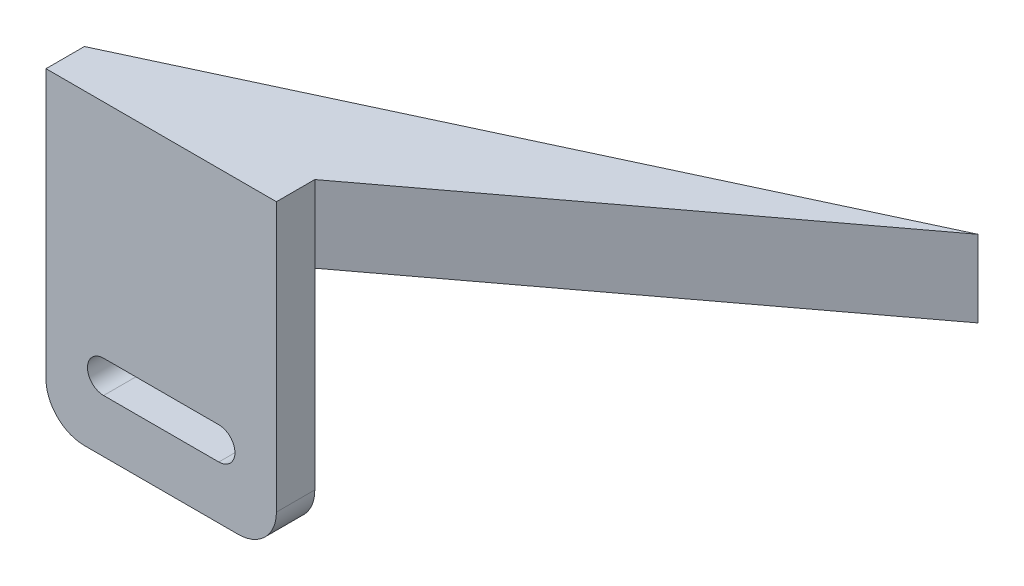
from build123d import *

# Parameters (mm, degrees)
SKETCH1_W           = 30
SKETCH1_H           = 40
BOSS_EXTRUDE1_DEPTH = 5
BOSS_EXTRUDE2_DEPTH = 10
FILLET2_R           = 5
CUT_EXTRUDE1_DEPTH  = 10


with BuildPart() as part:
    # Sketch1 → Boss-Extrude1 (new body)
    with BuildSketch(Plane.XY):
        Rectangle(SKETCH1_W, SKETCH1_H)
    extrude(amount=BOSS_EXTRUDE1_DEPTH)

    # Sketch2 → Boss-Extrude2 (add)
    with BuildSketch(Plane(origin=(0, 20, 0), x_dir=(1, 0, 0), z_dir=(0, 1, 0))):
        Polygon((-15, 0), (64.346756059, 37), (15, 0), align=None)
    extrude(amount=-BOSS_EXTRUDE2_DEPTH)

    # Fillet2
    fillet2_edges = [part.edges().sort_by_distance(p)[0] for p in [
        (15, -20, 2.5),
        (-15, -20, 2.5),
    ]]
    fillet(fillet2_edges, radius=FILLET2_R)

    # Sketch4 → Cut-Extrude1 (cut)
    with BuildSketch(Plane.XY.offset(5)):
        with BuildLine():
            Line((7.5, -13.1), (-7.5, -13.1))
            ThreePointArc((-7.5, -13.1), (-9.6, -11), (-7.5, -8.9))
            Line((-7.5, -8.9), (7.5, -8.9))
            ThreePointArc((7.5, -8.9), (9.6, -11), (7.5, -13.1))
        make_face()
    extrude(amount=-CUT_EXTRUDE1_DEPTH, mode=Mode.SUBTRACT)


solid = part.part
